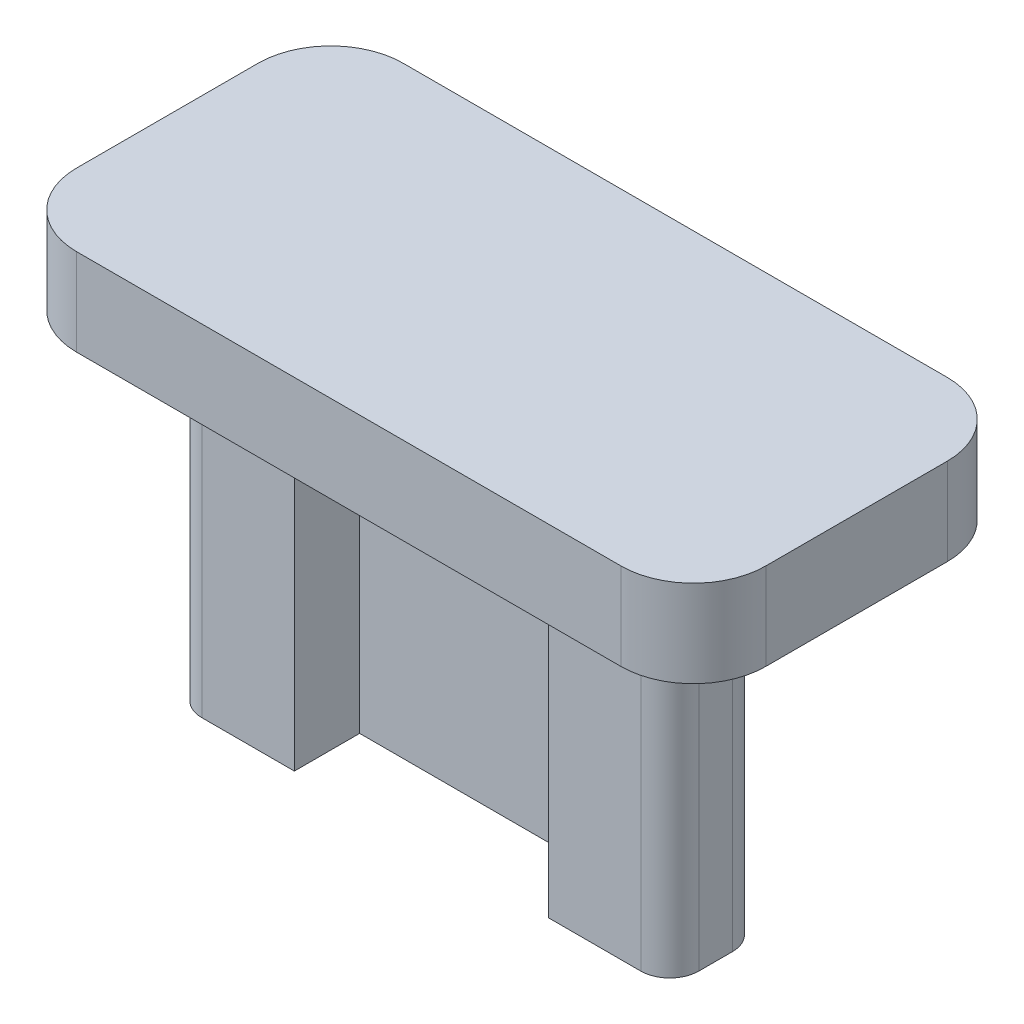
from build123d import *

# Parameters (mm, degrees)
SKETCH1_W           = 9.5
SKETCH1_H           = 4.5
BOSS_EXTRUDE1_DEPTH = 1.2
BOSS_EXTRUDE2_DEPTH = 4.5
SKETCH4_W           = 3.5
SKETCH4_H           = 0.9
CUT_EXTRUDE2_DEPTH  = 4.5
FILLET2_R           = 0.4
FILLET3_R           = 1


with BuildPart() as part:
    # Sketch1 → Boss-Extrude1 (new body)
    with BuildSketch(Plane(origin=(0, 3.3, 0), x_dir=(1, 0, 0), z_dir=(0, 1, 0))):
        with Locations((0, 0.35)):
            Rectangle(SKETCH1_W, SKETCH1_H)
    extrude(amount=-BOSS_EXTRUDE1_DEPTH)

    # Sketch2 → Boss-Extrude2 (add)
    with BuildSketch(Plane.XZ.offset(-2.1)):
        Polygon((3.425, -0.13), (2.65, -0.9), (-2.65, -0.9), (-3.425, -0.13), (-3.425, 0.9), (3.425, 0.9), align=None)
    extrude(amount=BOSS_EXTRUDE2_DEPTH)

    # Sketch4 → Cut-Extrude2 (cut)
    with BuildSketch(Plane.XZ.offset(2.4)):
        with Locations((0, 0.45)):
            Rectangle(SKETCH4_W, SKETCH4_H)
    extrude(amount=-CUT_EXTRUDE2_DEPTH, mode=Mode.SUBTRACT)

    # Fillet2
    fillet2_edges = [part.edges().sort_by_distance(p)[0] for p in [
        (3.425, -0.15, -0.13),
        (3.425, -0.15, 0.9),
        (-3.425, -0.15, 0.9),
        (-3.425, -0.15, -0.13),
        (-2.65, -0.15, -0.9),
        (2.65, -0.15, -0.9),
    ]]
    fillet(fillet2_edges, radius=FILLET2_R)

    # Fillet3
    fillet3_edges = [part.edges().sort_by_distance(p)[0] for p in [
        (-4.75, 2.7, 1.9),
        (-4.75, 2.7, -2.6),
        (4.75, 2.7, -2.6),
        (4.75, 2.7, 1.9),
    ]]
    fillet(fillet3_edges, radius=FILLET3_R)


solid = part.part
